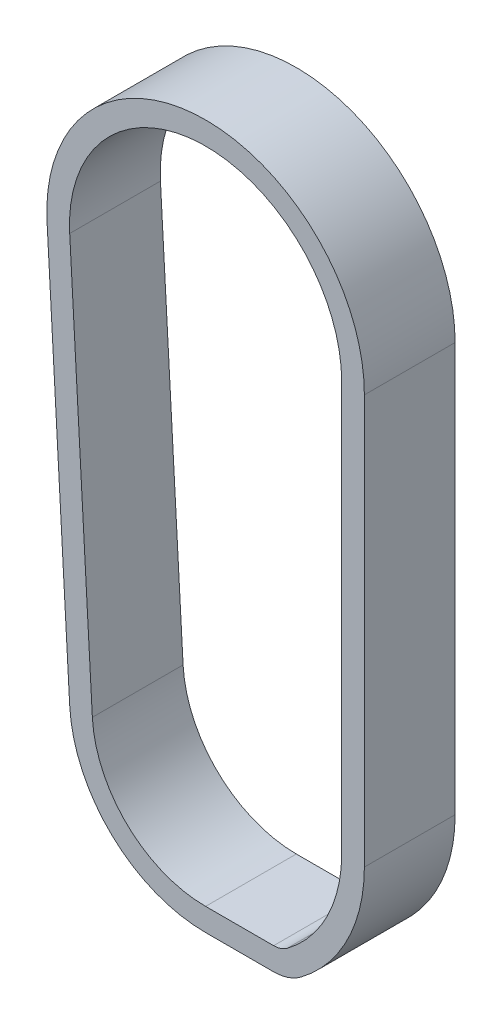
from build123d import *

# Parameters (mm, degrees)
BOSS_EXTRUDE1_DEPTH = 20


with BuildPart() as part:
    # Sketch1 → Boss-Extrude1 (new body)
    with BuildSketch(Plane.XY):
        with BuildLine():
            Line((35, -90.14), (35, 0))
            ThreePointArc((35, 0), (-0.97108607, 34.986525861), (-34.94611382, -1.941424451))
            Line((-34.94611382, -1.941424451), (-29.953811845, -91.804078101))
            ThreePointArc((-29.953811845, -91.804078101), (-20.616469836, -111.933603913), (0, -120.14))
            Line((0, -120.14), (15, -120.14))
            ThreePointArc((15, -120.14), (18.16227766, -119.626832981), (21, -118.14))
            ThreePointArc((21, -118.14), (31.304951685, -105.792475842), (35, -90.14))
        make_face()
        with BuildLine():
            Line((30, -90.14), (30, 0))
            ThreePointArc((30, 0), (-0.832359488, 29.988450738), (-29.953811845, -1.664078101))
            Line((-29.953811845, -1.664078101), (-24.961509871, -91.526731751))
            ThreePointArc((-24.961509871, -91.526731751), (-17.18039153, -108.301336594), (0, -115.14))
            Line((0, -115.14), (15, -115.14))
            ThreePointArc((15, -115.14), (16.58113883, -114.88341649), (18, -114.14))
            ThreePointArc((18, -114.14), (26.83281573, -103.556407865), (30, -90.14))
        make_face(mode=Mode.SUBTRACT)
    extrude(amount=BOSS_EXTRUDE1_DEPTH)


solid = part.part
